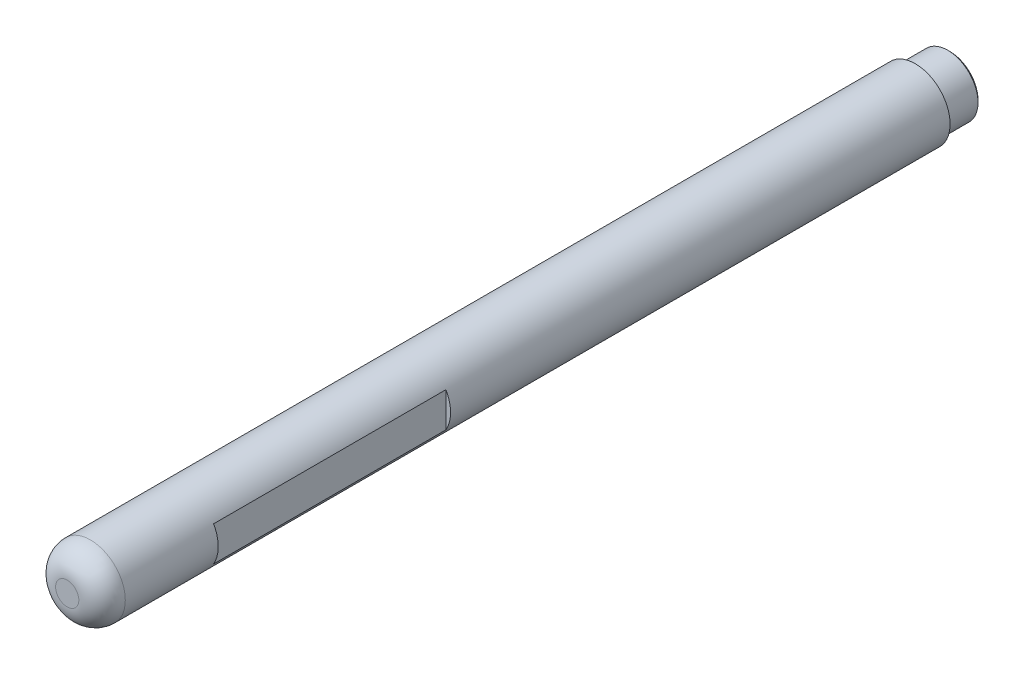
from build123d import *

# Parameters (mm, degrees)
ESBO_O1_R                     = 7.5
RESSALTO_EXTRUS_O1_DEPTH      = 95
CORTE_EXTRUS_O1_START         = -7.5
ESBO_O2_R                     = 7.5
ESBO_O2_R_2                   = 6.5
CORTE_EXTRUS_O1_DEPTH         = 7.5
FILETE1_R                     = 5
FURO_ROSCADO_DE_M6X1_01_D     = 5
FURO_ROSCADO_DE_M6X1_01_DEPTH = 15.497848452
FURO_ROSCADO_DE_M6X1_01_TIP   = 1.502151548
CHANFRO1_SIZE                 = 0.5
CORTE_EXTRUS_O2_DEPTH         = 96.590271472
CORTE_EXTRUS_O2_DEPTH_BACK    = 96.590271472
ESBO_O8_W                     = 1
ESBO_O8_H                     = 50


with BuildPart() as part:
    # Esboço1 → Ressalto-extrusão1 (new, symmetric)
    with BuildSketch(Plane.XY):
        Circle(ESBO_O1_R)
    extrude(amount=RESSALTO_EXTRUS_O1_DEPTH, both=True)

    # Esboço2 → Corte-extrusão1 (cut)
    with BuildSketch(Plane(origin=(0, 0, -95), x_dir=(-1, 0, 0), z_dir=(0, 0, -1)).offset(CORTE_EXTRUS_O1_START)):
        Circle(ESBO_O2_R)
        Circle(ESBO_O2_R_2, mode=Mode.SUBTRACT)
    extrude(amount=CORTE_EXTRUS_O1_DEPTH, mode=Mode.SUBTRACT)

    # Filete1
    filete1_edges = [part.edges().sort_by_distance(p)[0] for p in [
        (-7.5, 0, 95),
    ]]
    fillet(filete1_edges, radius=FILETE1_R)

    # Furo roscado de M6x1.01
    with Locations(Plane(origin=(0, 0, -95), x_dir=(-1, 0, 0), z_dir=(0, 0, -1))):
        with Locations((0, 0)):
            Hole(FURO_ROSCADO_DE_M6X1_01_D / 2, depth=FURO_ROSCADO_DE_M6X1_01_DEPTH)
            with Locations((0, 0, -(FURO_ROSCADO_DE_M6X1_01_DEPTH + FURO_ROSCADO_DE_M6X1_01_TIP / 2))):  # 118° drill point
                Cone(0, FURO_ROSCADO_DE_M6X1_01_D / 2, FURO_ROSCADO_DE_M6X1_01_TIP, mode=Mode.SUBTRACT)

    # Chanfro1
    chanfro1_edges = [part.edges().sort_by_distance(p)[0] for p in [
        (6.5, 0, -95),
    ]]
    chamfer(chanfro1_edges, length=CHANFRO1_SIZE)

    # Esboço8 → Corte-extrusão2 (cut, two sides: drawn at the far end of the back side and taken through both)
    with BuildSketch(Plane(origin=(0, 0, 0), x_dir=(1, 0, 0), z_dir=(0, 1, 0)).offset(-CORTE_EXTRUS_O2_DEPTH_BACK)):
        with Locations((7, -45)):
            Rectangle(ESBO_O8_W, ESBO_O8_H)
    extrude(amount=CORTE_EXTRUS_O2_DEPTH + CORTE_EXTRUS_O2_DEPTH_BACK, mode=Mode.SUBTRACT)


solid = part.part
